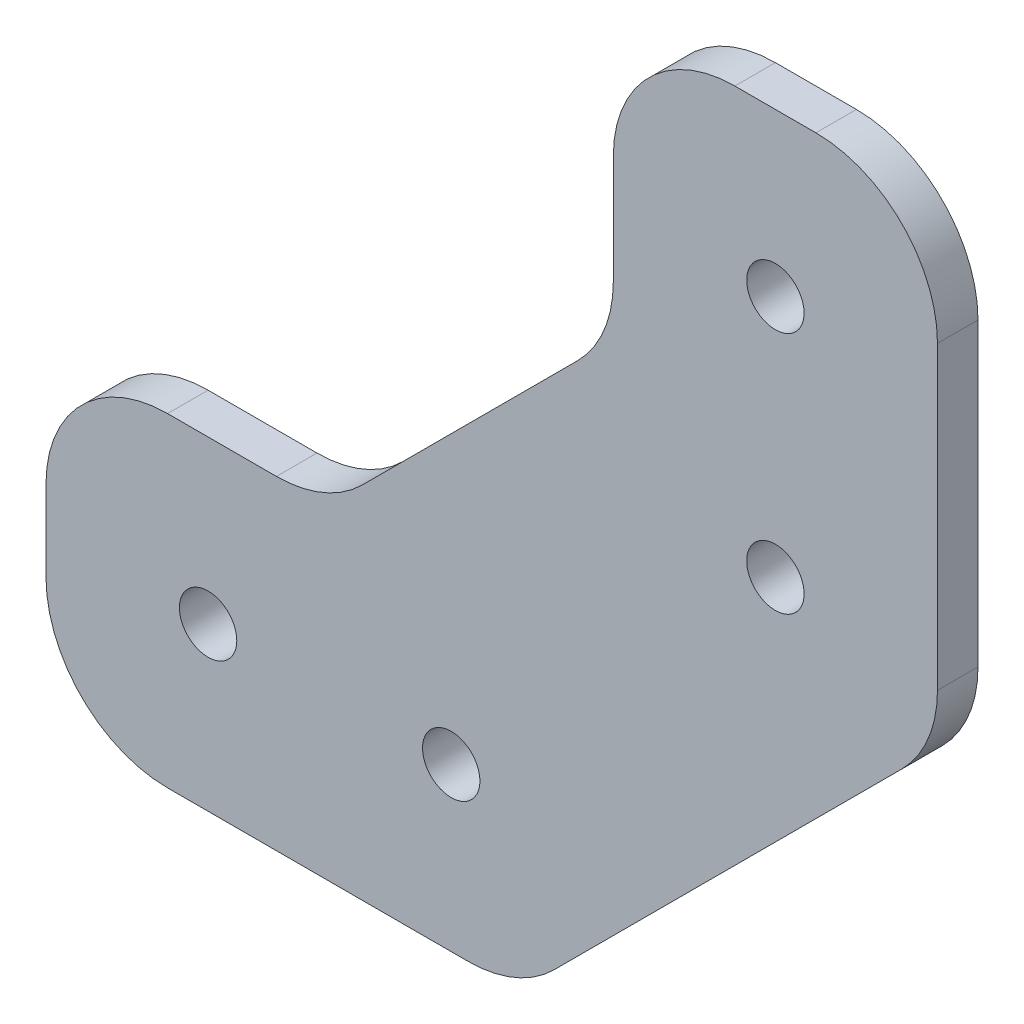
from build123d import *

# Parameters (mm, degrees)
BOSS_EXTRUDE1_DEPTH   = 1.5875
FILLET1_R             = 9.525
F_8_CLEARANCE_HOLE1_D = 4.4958


with BuildPart() as part:
    # Sketch2 → Boss-Extrude1 (new, symmetric)
    with BuildSketch(Plane.XY):
        Polygon((37.010512242, 0), (69.85, 32.839487758), (69.85, 69.85), (44.45, 69.85), (44.45, 47.850640303), (21.999359697, 25.4), (0, 25.4), (0, 0), align=None)
    extrude(amount=BOSS_EXTRUDE1_DEPTH, both=True)

    # Fillet1
    fillet1_edges = [part.edges().sort_by_distance(p)[0] for p in [
        (69.85, 32.839487758, 0),
        (37.010512242, 0, 0),
        (0, 0, 0),
        (0, 25.4, 0),
        (21.999359697, 25.4, 0),
        (44.45, 47.850640303, 0),
        (44.45, 69.85, 0),
        (69.85, 69.85, 0),
    ]]
    fillet(fillet1_edges, radius=FILLET1_R)

    # #8 Clearance Hole1 (through all)
    with Locations(Plane.XY.offset(1.5875)):
        with Locations((12.7, 12.7), (31.75, 12.7), (57.15, 38.1), (57.15, 57.15)):
            Hole(F_8_CLEARANCE_HOLE1_D / 2)


solid = part.part
